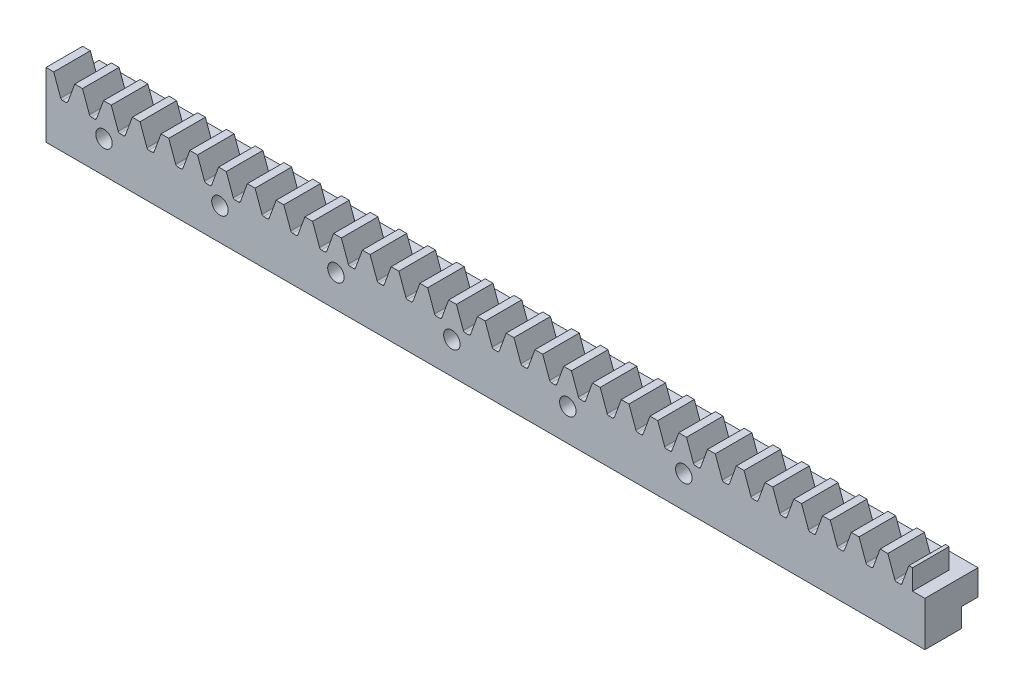
from build123d import *

# Parameters (mm, degrees)
SKETCH2_W                       = 10.000000066
SKETCH2_H                       = 25
BOSS_EXTRUDE1_DEPTH             = 120.00000003
CUT_EXTRUDE1_DEPTH              = 123.678441495
FILLET1_R                       = 0.511857011
LPATTERN1_COUNT                 = 30
LPATTERN1_PITCH                 = 7.853981634
FILLET1_OF_LPATTERN1_R          = 0.511857011
ESQUISSE1_W                     = 240.00000006
ESQUISSE1_H                     = 7.3
ENL_V_MAT_EXTRU_1_DEPTH         = 123.983738797
ESQUISSE6_W                     = 240.00000006
ESQUISSE6_H                     = 8.731369012
BOSS_EXTRU_1_DEPTH              = 4.5
DIAM_TRE_DU_PER_AGE_4_5_4_5_1_D = 4.5
ESQUISSE8_W                     = 240.00000006
ESQUISSE8_H                     = 1.782164191
ENL_V_MAT_EXTRU_3_DEPTH         = 4.5
ESQUISSE9_W                     = 3.380551041
ESQUISSE9_H                     = 5.5508
ENL_V_MAT_EXTRU_4_DEPTH         = 123.983738797


with BuildPart() as part:
    # Sketch2 → Boss-Extrude1 (new, symmetric)
    with BuildSketch(Plane(origin=(0, 0, 0), x_dir=(0, 0, -1), z_dir=(1, 0, 0))):
        with Locations((0, 12.5)):
            Rectangle(SKETCH2_W, SKETCH2_H)
    extrude(amount=BOSS_EXTRUDE1_DEPTH, both=True)

    # Sketch3 → Cut-Extrude1 (cut, symmetric)
    with BuildSketch(Plane.XY):
        Polygon((-117.892860384, 25), (-115.872534408, 19.4492), (-114.166344372, 19.4492), (-112.146018396, 25), align=None)
    cut_extrude1 = extrude(amount=CUT_EXTRUDE1_DEPTH, both=True, mode=Mode.SUBTRACT)

    # Fillet1
    fillet1_edges = [part.edges().sort_by_distance(p)[0] for p in [
        (-114.166344372, 19.4492, 0),
        (-115.872534408, 19.4492, 0),
    ]]
    fillet(fillet1_edges, radius=FILLET1_R)

    # LPattern1: Cut-Extrude1 ×30
    with Locations(*[(i * LPATTERN1_PITCH, 0, 0) for i in range(1, LPATTERN1_COUNT)]):
        add(cut_extrude1, mode=Mode.SUBTRACT)

    # Fillet1 of LPattern1
    fillet1_of_lpattern1_edges = [part.edges().sort_by_distance(p)[0] for p in [
        (-106.312362738, 19.4492, 0),
        (-108.018552774, 19.4492, 0),
        (-98.458381104, 19.4492, 0),
        (-100.16457114, 19.4492, 0),
        (-90.60439947, 19.4492, 0),
        (-92.310589506, 19.4492, 0),
        (-82.750417836, 19.4492, 0),
        (-84.456607872, 19.4492, 0),
        (-74.896436203, 19.4492, 0),
        (-76.602626238, 19.4492, 0),
        (-67.042454569, 19.4492, 0),
        (-68.748644604, 19.4492, 0),
        (-59.188472935, 19.4492, 0),
        (-60.89466297, 19.4492, 0),
        (-51.334491301, 19.4492, 0),
        (-53.040681336, 19.4492, 0),
        (-43.480509667, 19.4492, 0),
        (-45.186699702, 19.4492, 0),
        (-35.626528033, 19.4492, 0),
        (-37.332718068, 19.4492, 0),
        (-27.772546399, 19.4492, 0),
        (-29.478736434, 19.4492, 0),
        (-19.918564765, 19.4492, 0),
        (-21.6247548, 19.4492, 0),
        (-12.064583131, 19.4492, 0),
        (-13.770773166, 19.4492, 0),
        (-4.210601497, 19.4492, 0),
        (-5.916791532, 19.4492, 0),
        (3.643380137, 19.4492, 0),
        (1.937190102, 19.4492, 0),
        (11.497361771, 19.4492, 0),
        (9.791171736, 19.4492, 0),
        (19.351343405, 19.4492, 0),
        (17.64515337, 19.4492, 0),
        (27.205325039, 19.4492, 0),
        (25.499135004, 19.4492, 0),
        (35.059306673, 19.4492, 0),
        (33.353116638, 19.4492, 0),
        (42.913288307, 19.4492, 0),
        (41.207098272, 19.4492, 0),
        (50.767269941, 19.4492, 0),
        (49.061079905, 19.4492, 0),
        (58.621251575, 19.4492, 0),
        (56.915061539, 19.4492, 0),
        (66.475233209, 19.4492, 0),
        (64.769043173, 19.4492, 0),
        (74.329214843, 19.4492, 0),
        (72.623024807, 19.4492, 0),
        (82.183196477, 19.4492, 0),
        (80.477006441, 19.4492, 0),
        (90.037178111, 19.4492, 0),
        (88.330988075, 19.4492, 0),
        (97.891159745, 19.4492, 0),
        (96.184969709, 19.4492, 0),
        (105.745141379, 19.4492, 0),
        (104.038951343, 19.4492, 0),
        (113.599123013, 19.4492, 0),
        (111.892932977, 19.4492, 0),
    ]]
    fillet(fillet1_of_lpattern1_edges, radius=FILLET1_OF_LPATTERN1_R)

    # Esquisse1 → Enlèv. mat.-Extru.1 (cut, through all)
    with BuildSketch(Plane.XY.offset(5.000000033)):
        with Locations((0, 3.65)):
            Rectangle(ESQUISSE1_W, ESQUISSE1_H)
    extrude(amount=-ENL_V_MAT_EXTRU_1_DEPTH, mode=Mode.SUBTRACT)

    # Esquisse6 → Boss.-Extru.1 (add)
    with BuildSketch(Plane(origin=(0, 0, -5.000000033), x_dir=(-1, 0, 0), z_dir=(0, 0, -1))):
        with Locations((0, 16.865679685)):
            Rectangle(ESQUISSE6_W, ESQUISSE6_H)
    extrude(amount=BOSS_EXTRU_1_DEPTH)

    # Diamètre du perçage Ø4.5 (4.5)1 (through all)
    with Locations(Plane.XY.offset(5.000000033)):
        with Locations((-104.166666697, 16.05599518), (54.166666637, 16.05599518), (22.49999997, 16.05599518), (-9.166666697, 16.05599518), (-40.833333363, 16.05599518), (-72.50000003, 16.05599518)):
            Hole(DIAM_TRE_DU_PER_AGE_4_5_4_5_1_D / 2)

    # Esquisse8 → Enlèv. mat.-Extru.3 (cut)
    with BuildSketch(Plane(origin=(0, 0, -9.500000033), x_dir=(-1, 0, 0), z_dir=(0, 0, -1))):
        with Locations((0, 20.340282096)):
            Rectangle(ESQUISSE8_W, ESQUISSE8_H)
    extrude(amount=-ENL_V_MAT_EXTRU_3_DEPTH, mode=Mode.SUBTRACT)

    # Esquisse9 → Enlèv. mat.-Extru.4 (cut, through all)
    with BuildSketch(Plane(origin=(0, 0, -5.000000033), x_dir=(-1, 0, 0), z_dir=(0, 0, -1))):
        with Locations((-118.30972451, 22.2246)):
            Rectangle(ESQUISSE9_W, ESQUISSE9_H)
    extrude(amount=-ENL_V_MAT_EXTRU_4_DEPTH, mode=Mode.SUBTRACT)


solid = part.part
